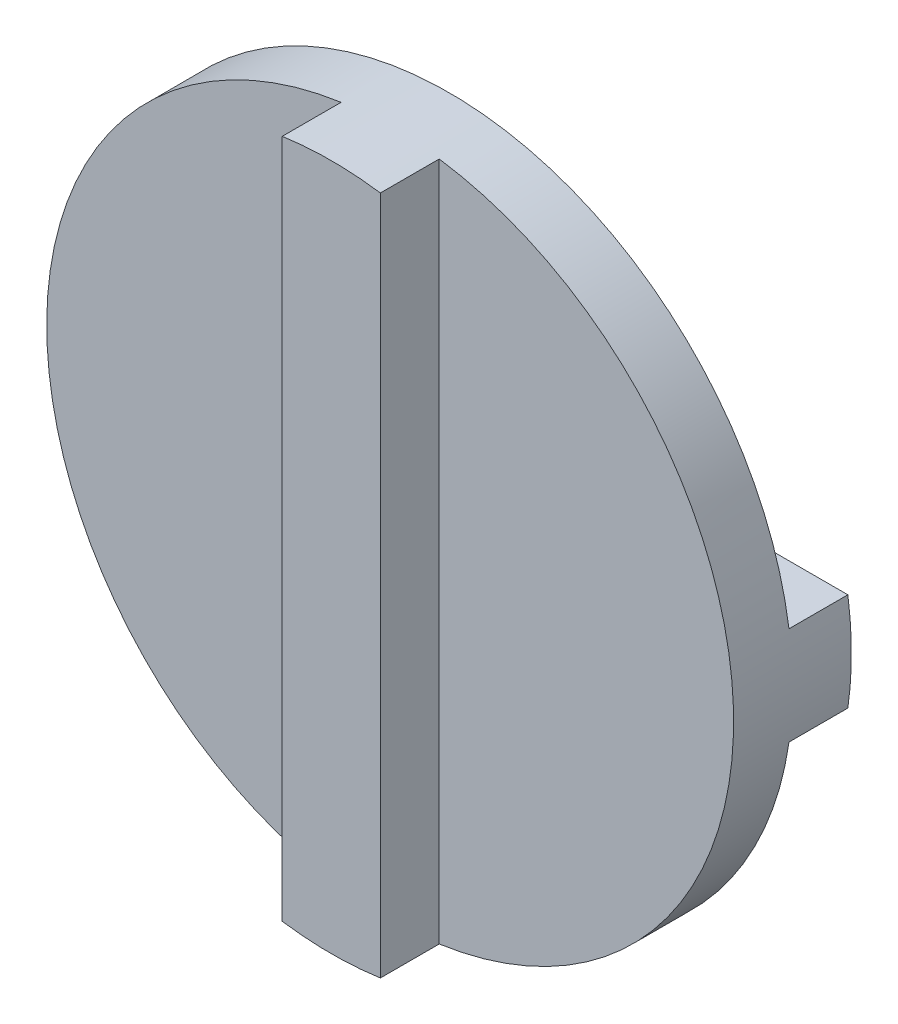
from build123d import *
from build123d.topology import SkipClean

# Parameters (mm, degrees)
SKETCH1_R           = 175
BOSS_EXTRUDE1_DEPTH = 30
BOSS_EXTRUDE2_DEPTH = 30
BOSS_EXTRUDE3_START = 30
BOSS_EXTRUDE3_DEPTH = 30


with BuildPart() as part:
    # Sketch1 → Boss-Extrude1 (new body)
    with BuildSketch(Plane.XY):
        Circle(SKETCH1_R)
    extrude(amount=BOSS_EXTRUDE1_DEPTH)

    # Sketch2 → Boss-Extrude2 (add)
    with SkipClean():  # the faces are left unmerged after this step: merging them gives an invalid solid
        with BuildSketch(Plane.XY.offset(30)):
            with BuildLine():
                Line((25, 173.205080757), (25, -173.205080757))
                ThreePointArc((25, -173.205080757), (0, -175), (-25, -173.205080757))
                Line((-25, -173.205080757), (-25, 173.205080757))
                ThreePointArc((-25, 173.205080757), (0, 175), (25, 173.205080757))
            make_face()
        extrude(amount=BOSS_EXTRUDE2_DEPTH)

    # Sketch3 → Boss-Extrude3 (add)
    with SkipClean():  # the faces are left unmerged after this step: merging them gives an invalid solid
        with BuildSketch(Plane(origin=(0, 0, 0), x_dir=(-1, 0, 0), z_dir=(0, 0, -1)).offset(BOSS_EXTRUDE3_START)):
            with BuildLine():
                Line((-173.205080757, 25), (173.205080757, 25))
                ThreePointArc((173.205080757, 25), (175, 0), (173.205080757, -25))
                Line((173.205080757, -25), (-173.205080757, -25))
                ThreePointArc((-173.205080757, -25), (-175, 0), (-173.205080757, 25))
            make_face()
        extrude(amount=-BOSS_EXTRUDE3_DEPTH)


solid = part.part
